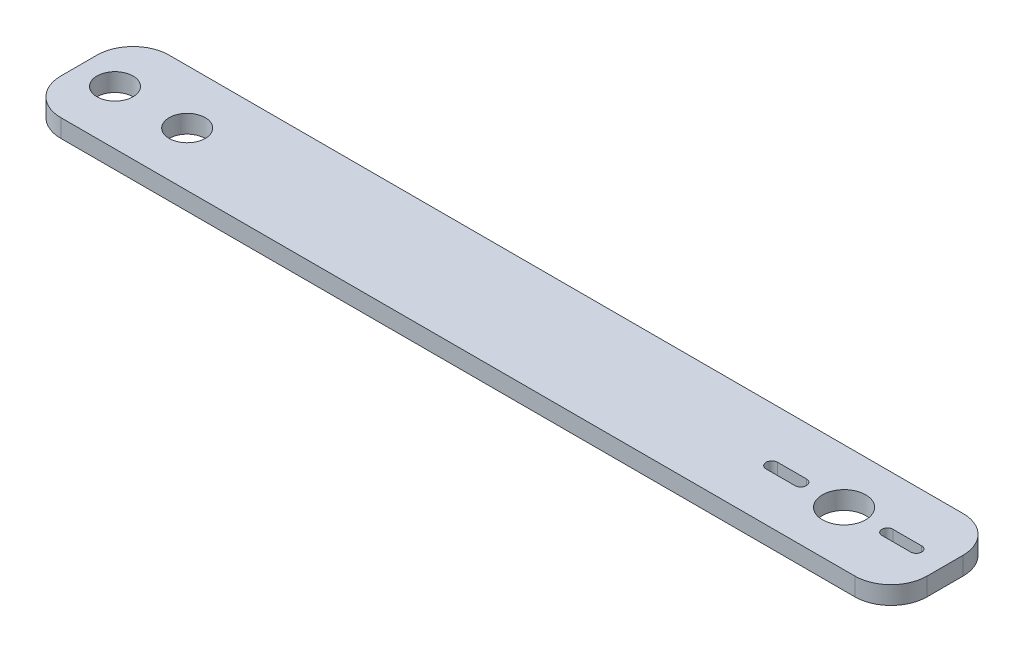
from build123d import *

# Parameters (mm, degrees)
SKETCH1_W           = 152.4
SKETCH1_H           = 19.05
BOSS_EXTRUDE1_DEPTH = 3.175
FILLET1_R           = 6.35
SKETCH2_R           = 3.175
SKETCH2_R_2         = 3.81
CUT_EXTRUDE1_DEPTH  = 100.507657605


with BuildPart() as part:
    # Sketch1 → Boss-Extrude1 (new body)
    with BuildSketch(Plane(origin=(0, 0, 0), x_dir=(1, 0, 0), z_dir=(0, 1, 0))):
        with Locations((21.802018925, 7.424854969)):
            Rectangle(SKETCH1_W, SKETCH1_H)
    extrude(amount=BOSS_EXTRUDE1_DEPTH)

    # Fillet1
    fillet1_edges = [part.edges().sort_by_distance(p)[0] for p in [
        (-54.397981075, 1.5875, -16.949854969),
        (98.002018925, 1.5875, -16.949854969),
        (98.002018925, 1.5875, 2.100145031),
        (-54.397981075, 1.5875, 2.100145031),
    ]]
    fillet(fillet1_edges, radius=FILLET1_R)

    # Sketch2 → Cut-Extrude1 (cut, through all)
    with BuildSketch(Plane(origin=(0, 3.175, 0), x_dir=(1, 0, 0), z_dir=(0, 1, 0))):
        with Locations(Location((-48.047981075, 7.424854969, 0), (0, 0, 270))):
            Circle(SKETCH2_R)
        with Locations(Location((-35.347981075, 7.424854969, 0), (0, 0, 270))):
            Circle(SKETCH2_R)
        with Locations(Location((80.222018925, 7.424854969, 0), (0, 0, 270))):
            Circle(SKETCH2_R_2)
        with BuildLine():
            Line((87.842018925, 8.377354969), (92.922018925, 8.377354969))
            ThreePointArc((92.922018925, 8.377354969), (93.874518925, 7.424854969), (92.922018925, 6.472354969))
            Line((92.922018925, 6.472354969), (87.842018925, 6.472354969))
            ThreePointArc((87.842018925, 6.472354969), (86.889518925, 7.424854969), (87.842018925, 8.377354969))
        make_face()
        with BuildLine():
            Line((72.602018925, 6.408854969), (67.522018925, 6.408854969))
            ThreePointArc((67.522018925, 6.408854969), (66.506018925, 7.424854969), (67.522018925, 8.440854969))
            Line((67.522018925, 8.440854969), (72.602018925, 8.440854969))
            ThreePointArc((72.602018925, 8.440854969), (73.618018925, 7.424854969), (72.602018925, 6.408854969))
        make_face()
    extrude(amount=-CUT_EXTRUDE1_DEPTH, mode=Mode.SUBTRACT)


solid = part.part
